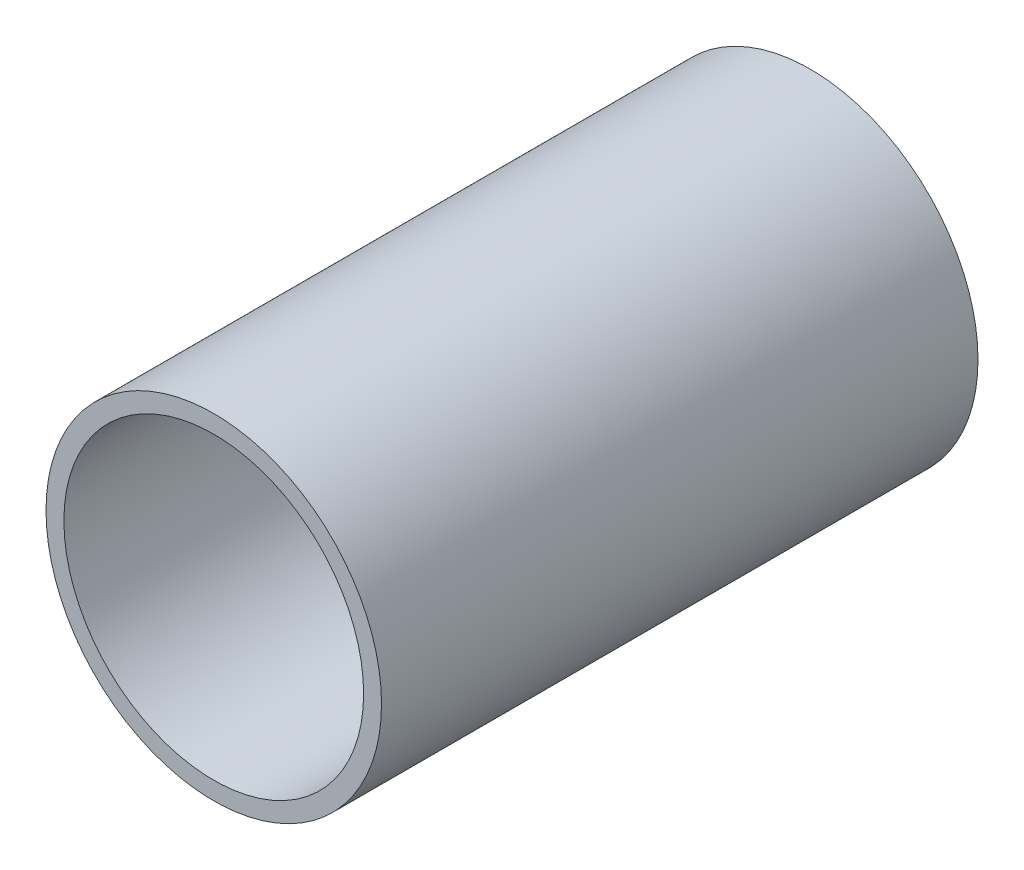
from build123d import *

# Parameters (mm, degrees)
SKETCH3_R           = 28.575
SKETCH3_R_2         = 25.527
BOSS_EXTRUDE1_DEPTH = 50.8


with BuildPart() as part:
    # Sketch3 → Boss-Extrude1 (new, symmetric)
    with BuildSketch(Plane.XY):
        Circle(SKETCH3_R)
        Circle(SKETCH3_R_2, mode=Mode.SUBTRACT)
    extrude(amount=BOSS_EXTRUDE1_DEPTH, both=True)


solid = part.part
